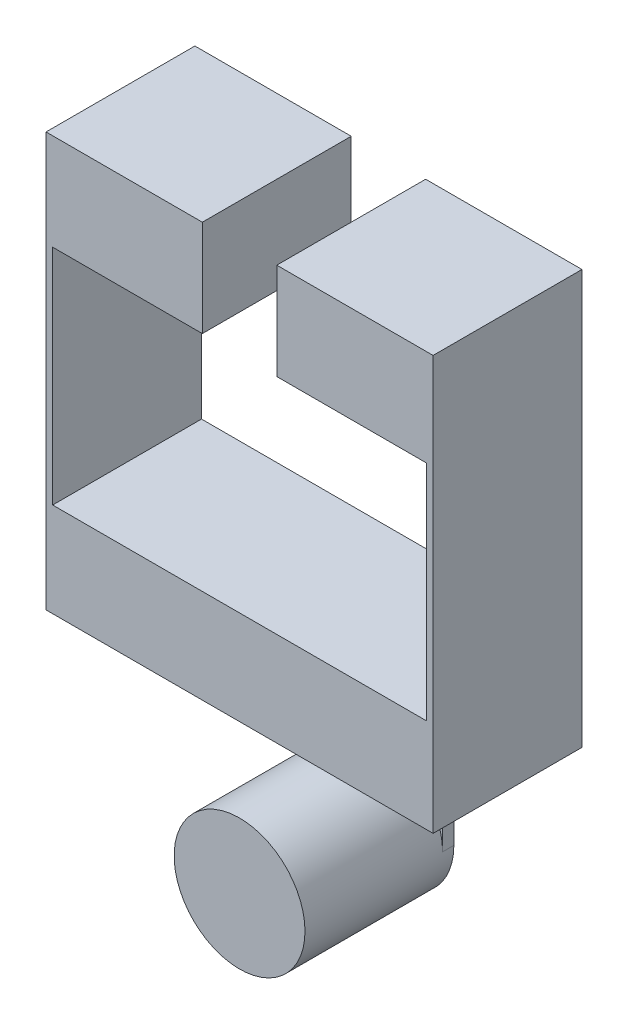
from build123d import *

# Parameters (mm, degrees)
SKETCH1_R           = 11.162804955
BOSS_EXTRUDE1_DEPTH = 25.4
BOSS_EXTRUDE2_START = -1.926431551
BOSS_EXTRUDE2_DEPTH = 1.926431551
SKETCH4_W           = 66.04
SKETCH4_H           = 25.4
BOSS_EXTRUDE3_DEPTH = 16.064370514
SKETCH5_W           = 1.129641984
SKETCH5_H           = 25.4
BOSS_EXTRUDE4_DEPTH = 38.1
SKETCH6_W           = 26.67
SKETCH6_H           = 25.4
BOSS_EXTRUDE5_DEPTH = 16.461081374


with BuildPart() as part:
    # Sketch1 → Boss-Extrude1 (new body)
    with BuildSketch(Plane.XY):
        Circle(SKETCH1_R)
    extrude(amount=-BOSS_EXTRUDE1_DEPTH)

    # Sketch2 → Boss-Extrude2 (add)
    with BuildSketch(Plane(origin=(0, 0, -25.4), x_dir=(-1, 0, 0), z_dir=(0, 0, -1)).offset(BOSS_EXTRUDE2_START)):
        with BuildLine():
            Line((-11.162804955, 0), (-11.162804955, 25.4))
            Line((-11.162804955, 25.4), (11.162804955, 25.4))
            Line((11.162804955, 25.4), (11.162804955, 0))
            ThreePointArc((11.162804955, 0), (0, 11.162804955), (-11.162804955, 0))
        make_face()
    extrude(amount=BOSS_EXTRUDE2_DEPTH)

    # Sketch4 → Boss-Extrude3 (add)
    with BuildSketch(Plane(origin=(0, 25.4, 0), x_dir=(1, 0, 0), z_dir=(0, 1, 0))):
        with Locations((0, 12.7)):
            Rectangle(SKETCH4_W, SKETCH4_H)
    extrude(amount=BOSS_EXTRUDE3_DEPTH)

    # Sketch5 → Boss-Extrude4 (add)
    with BuildSketch(Plane(origin=(0, 41.464370514, 0), x_dir=(1, 0, 0), z_dir=(0, 1, 0))):
        with Locations((-32.455179008, 12.7)):
            Rectangle(SKETCH5_W, SKETCH5_H)
        with Locations((32.455179008, 12.7)):
            Rectangle(SKETCH5_W, SKETCH5_H)
    extrude(amount=BOSS_EXTRUDE4_DEPTH)

    # Sketch6 → Boss-Extrude5 (add)
    with BuildSketch(Plane(origin=(0, 79.564370514, 0), x_dir=(1, 0, 0), z_dir=(0, 1, 0))):
        with Locations((19.685, 12.7)):
            Rectangle(SKETCH6_W, SKETCH6_H)
        with Locations((-19.685, 12.7)):
            Rectangle(SKETCH6_W, SKETCH6_H)
    extrude(amount=BOSS_EXTRUDE5_DEPTH)


solid = part.part
